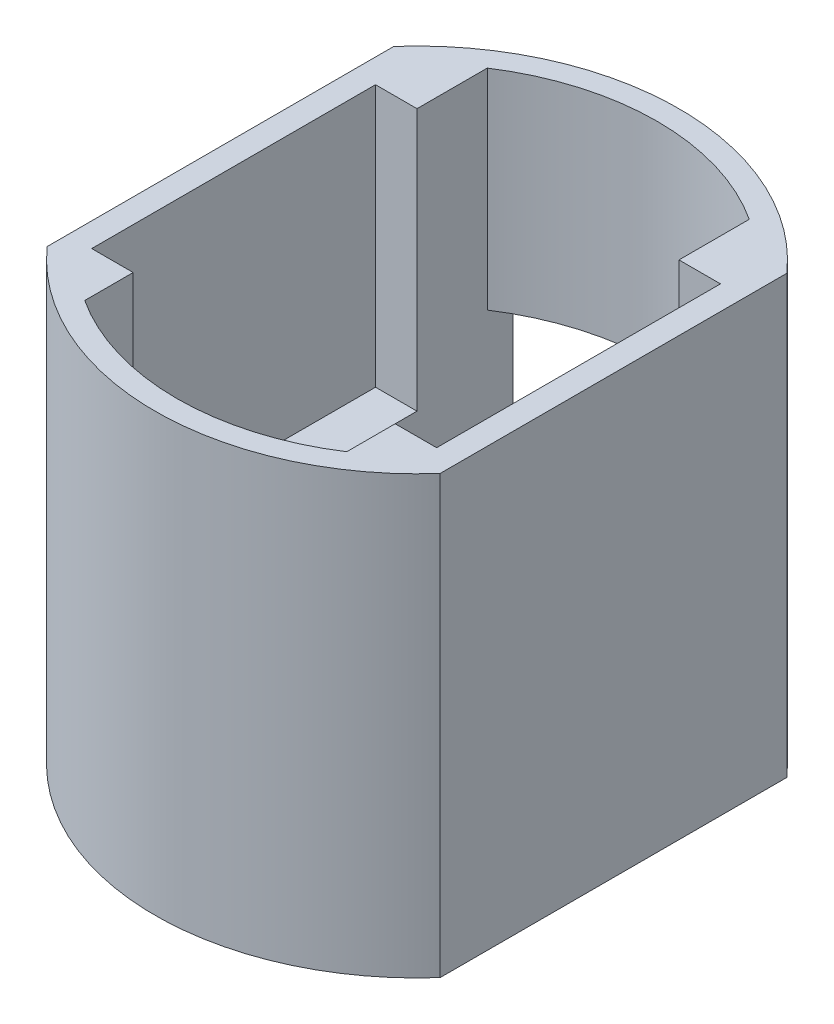
from build123d import *

# Parameters (mm, degrees)
SKETCH1_R           = 76.2
BOSS_EXTRUDE1_DEPTH = 127
CUT_EXTRUDE1_DEPTH  = 76.2
SKETCH3_W           = 76.2
SKETCH3_H           = 89.15290971
CUT_EXTRUDE2_DEPTH  = 66.04
CUT_EXTRUDE4_DEPTH  = 167.558938517
SKETCH6_W           = 100.33
SKETCH6_H           = 82.55
CUT_EXTRUDE6_DEPTH  = 76.2


with BuildPart() as part:
    # Sketch1 → Boss-Extrude1 (new body)
    with BuildSketch(Plane(origin=(0, 0, 0), x_dir=(1, 0, 0), z_dir=(0, 1, 0))):
        with Locations(Location((0, 0, 0), (0, 0, 270))):
            Circle(SKETCH1_R)
    extrude(amount=BOSS_EXTRUDE1_DEPTH)

    # Sketch2 → Cut-Extrude1 (cut)
    with BuildSketch(Plane(origin=(0, 127, 0), x_dir=(1, 0, 0), z_dir=(0, 1, 0))):
        with BuildLine():
            Line((38.1, -58.544107304), (38.1, 58.544107304))
            ThreePointArc((38.1, 58.544107304), (0, 69.85), (-38.1, 58.544107304))
            Line((-38.1, 58.544107304), (-38.1, -58.544107304))
            ThreePointArc((-38.1, -58.544107304), (0, -69.85), (38.1, -58.544107304))
        make_face()
    extrude(amount=-CUT_EXTRUDE1_DEPTH, mode=Mode.SUBTRACT)

    # Sketch3 → Cut-Extrude2 (cut)
    with BuildSketch(Plane.XZ):
        with Locations((0, -21.414680913)):
            Rectangle(SKETCH3_W, SKETCH3_H)
        with BuildLine():
            Line((38.1, -65.991135768), (-38.1, -65.991135768))
            ThreePointArc((-38.1, -65.991135768), (0, -76.2), (38.1, -65.991135768))
        make_face()
    extrude(amount=-CUT_EXTRUDE2_DEPTH, mode=Mode.SUBTRACT)

    # Sketch5 → Cut-Extrude4 (cut, through all)
    with BuildSketch(Plane(origin=(0, 127, 0), x_dir=(1, 0, 0), z_dir=(0, 1, 0))):
        with BuildLine():
            Line((-57.15, 50.401562476), (-57.15, -50.401562476))
            ThreePointArc((-57.15, -50.401562476), (-76.2, 0), (-57.15, 50.401562476))
        make_face()
        with BuildLine():
            Line((57.15, 50.401562476), (57.15, -50.401562476))
            ThreePointArc((57.15, -50.401562476), (76.2, 0), (57.15, 50.401562476))
        make_face()
    extrude(amount=-CUT_EXTRUDE4_DEPTH, mode=Mode.SUBTRACT)

    # Sketch6 → Cut-Extrude6 (cut)
    with BuildSketch(Plane(origin=(0, 127, 0), x_dir=(1, 0, 0), z_dir=(0, 1, 0))):
        with Locations((0, -3.175)):
            Rectangle(SKETCH6_W, SKETCH6_H)
    extrude(amount=-CUT_EXTRUDE6_DEPTH, mode=Mode.SUBTRACT)


solid = part.part
